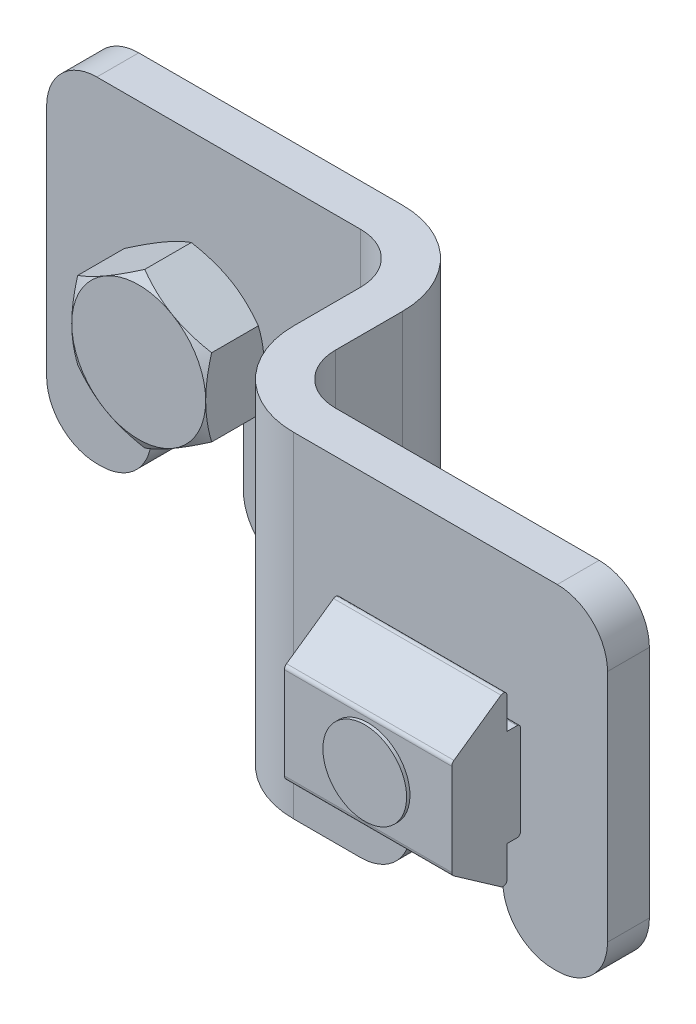
from build123d import *

# Parameters (mm, degrees)
BOSS_EXTRUDE1_DEPTH = 10
CUT_EXTRUDE1_DEPTH  = 42.158231255
FILLET1_R           = 3
BOSS_EXTRUDE2_DEPTH = 3.5
SKETCH4_W           = 8
SKETCH4_H           = 2.5
BOSS_EXTRUDE3_DEPTH = 5
CIRPATTERN1_COUNT   = 2
CIRPATTERN1_ANGLE   = 180


with BuildPart() as part:
    # Sketch1 → Boss-Extrude1 (new, symmetric)
    with BuildSketch(Plane(origin=(0, 0, 0), x_dir=(1, 0, 0), z_dir=(0, 1, 0))):
        with BuildLine():
            Line((-9, 0), (9.75, 0))
            ThreePointArc((9.75, 0), (13.639087297, -1.610912703), (15.25, -5.5))
            Line((15.25, -5.5), (15.25, -9.5))
            ThreePointArc((15.25, -9.5), (16.128679656, -11.621320344), (18.25, -12.5))
            Line((18.25, -12.5), (37, -12.5))
            Line((37, -12.5), (37, -15))
            Line((37, -15), (18.25, -15))
            ThreePointArc((18.25, -15), (14.360912703, -13.389087297), (12.75, -9.5))
            Line((12.75, -9.5), (12.75, -5.5))
            ThreePointArc((12.75, -5.5), (11.871320344, -3.378679656), (9.75, -2.5))
            Line((9.75, -2.5), (-9, -2.5))
            Line((-9, -2.5), (-9, 0))
        make_face()
    extrude(amount=BOSS_EXTRUDE1_DEPTH, both=True)

    # Sketch2 → Cut-Extrude1 (cut, through all)
    with BuildSketch(Plane.XY):
        with BuildLine():
            Line((-2.75, 0), (-2.75, -10))
            Line((-2.75, -10), (2.75, -10))
            Line((2.75, -10), (2.75, 0))
            ThreePointArc((2.75, 0), (0, 2.75), (-2.75, 0))
        make_face()
        with BuildLine():
            Line((25.25, 0), (25.25, -10))
            Line((25.25, -10), (30.75, -10))
            Line((30.75, -10), (30.75, 0))
            ThreePointArc((30.75, 0), (28, 2.75), (25.25, 0))
        make_face()
    extrude(amount=CUT_EXTRUDE1_DEPTH, mode=Mode.SUBTRACT)

    # Fillet1
    fillet1_edges = [part.edges().sort_by_distance(p)[0] for p in [
        (37, 10, 13.75),
        (37, -10, 13.75),
        (30.75, -10, 13.75),
        (25.25, -10, 13.75),
        (2.75, -10, 1.25),
        (-2.75, -10, 1.25),
        (-9, -10, 1.25),
        (-9, 10, 1.25),
    ]]
    fillet(fillet1_edges, radius=FILLET1_R)

    # Sketch3 → Boss-Extrude2 (add)
    with BuildSketch(Plane.XY.offset(2.5)):
        Polygon((0, 4.618802154), (-4, 2.309401077), (-4, -2.309401077), (0, -4.618802154), (4, -2.309401077), (4, 2.309401077), align=None)
    boss_extrude2 = extrude(amount=BOSS_EXTRUDE2_DEPTH)

    # Sketch4 → Revolve1 (revolve)
    with BuildSketch(Plane(origin=(0, 0, 0), x_dir=(0, 0, -1), z_dir=(1, 0, 0))):
        with Locations((1.5, 1.25)):
            Rectangle(SKETCH4_W, SKETCH4_H)
    revolve1 = revolve(axis=Axis((0, 0, -5.5), (0, 0, 1)))

    # Sketch5 → Cut-Revolve1 (revolve, cut)
    with BuildSketch(Plane(origin=(0, 0, 0), x_dir=(0, 0, -1), z_dir=(1, 0, 0))):
        Polygon((-2.5, 4.618802154), (-2.5, 4), (-2.85726559, 4.618802154), align=None)
        Polygon((-5.64273441, 4.618802154), (-6, 4.618802154), (-6, 4), align=None)
    cut_revolve1 = revolve(axis=Axis((0, 0, 2.5), (0, 0, 1)), mode=Mode.SUBTRACT)

    # Sketch6 → Boss-Extrude3 (add, symmetric)
    with BuildSketch(Plane(origin=(0, 0, 0), x_dir=(0, 0, -1), z_dir=(1, 0, 0))):
        with BuildLine():
            Line((5.172072931, 2.989575498), (2.36192258, 4.957263957))
            ThreePointArc((2.36192258, 4.957263957), (2.123797819, 4.972871479), (2, 4.768858987))
            Line((2, 4.768858987), (2, 2.9))
            Line((2, 2.9), (1.4, 2.9))
            ThreePointArc((1.4, 2.9), (1.258578644, 2.841421356), (1.2, 2.7))
            Line((1.2, 2.7), (1.2, -2.7))
            ThreePointArc((1.2, -2.7), (1.258578644, -2.841421356), (1.4, -2.9))
            Line((1.4, -2.9), (2, -2.9))
            Line((2, -2.9), (2, -4.768858987))
            ThreePointArc((2, -4.768858987), (2.123797819, -4.972871479), (2.36192258, -4.957263957))
            Line((2.36192258, -4.957263957), (5.172072931, -2.989575498))
            ThreePointArc((5.172072931, -2.989575498), (5.26610325, -2.882354469), (5.3, -2.743829885))
            Line((5.3, -2.743829885), (5.3, 2.743829885))
            ThreePointArc((5.3, 2.743829885), (5.26610325, 2.882354469), (5.172072931, 2.989575498))
        make_face()
    boss_extrude3 = extrude(amount=BOSS_EXTRUDE3_DEPTH, both=True)

    # CirPattern1: Boss-Extrude2, Revolve1, Cut-Revolve1, Boss-Extrude3 ×2 about axis
    cirpattern1_axis = Axis((14, 11, 7.5), (0, -1, 0))
    add([boss_extrude2.rotate(cirpattern1_axis, i * CIRPATTERN1_ANGLE / (CIRPATTERN1_COUNT - 1)) for i in range(1, CIRPATTERN1_COUNT)])
    add([revolve1.rotate(cirpattern1_axis, i * CIRPATTERN1_ANGLE / (CIRPATTERN1_COUNT - 1)) for i in range(1, CIRPATTERN1_COUNT)])
    add([cut_revolve1.rotate(cirpattern1_axis, i * CIRPATTERN1_ANGLE / (CIRPATTERN1_COUNT - 1)) for i in range(1, CIRPATTERN1_COUNT)], mode=Mode.SUBTRACT)
    add([boss_extrude3.rotate(cirpattern1_axis, i * CIRPATTERN1_ANGLE / (CIRPATTERN1_COUNT - 1)) for i in range(1, CIRPATTERN1_COUNT)])


solid = part.part
